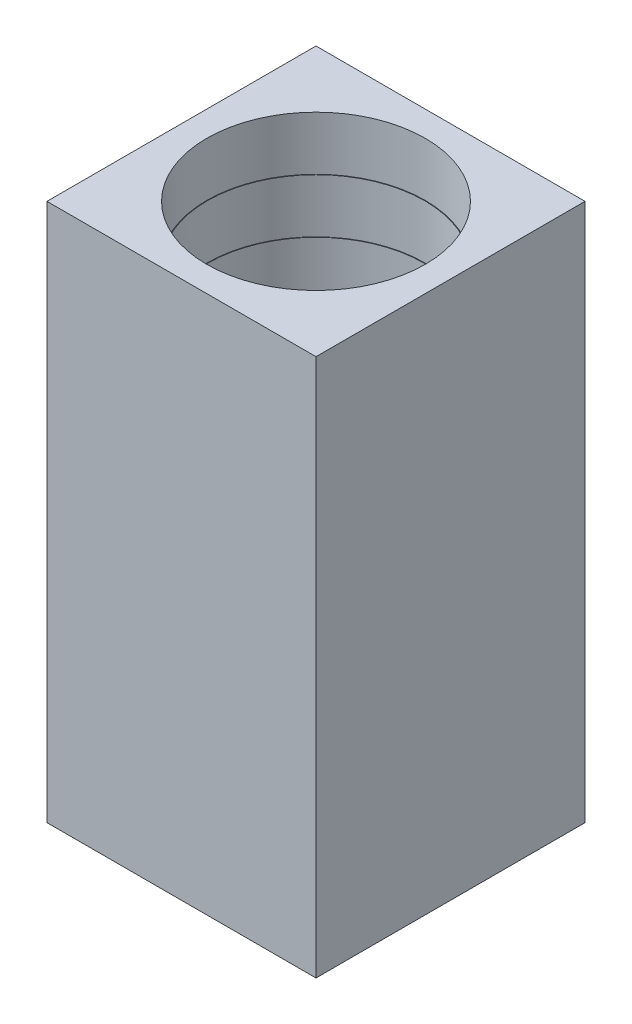
from build123d import *

# Parameters (mm, degrees)
SKETCH1_W           = 50
SKETCH1_H           = 50
BOSS_EXTRUDE1_DEPTH = 100
SKETCH2_R           = 19.9
CUT_EXTRUDE2_DEPTH  = 50
SKETCH2_5_R         = 20
SKETCH2_5_R_2       = 19.9
CUT_EXTRUDE3_DEPTH  = 40
SKETCH2_6_R         = 20.1
SKETCH2_6_R_2       = 20
CUT_EXTRUDE4_DEPTH  = 30
SKETCH2_7_R         = 20.2
SKETCH2_7_R_2       = 20.1
CUT_EXTRUDE5_DEPTH  = 20
SKETCH2_8_R         = 20.3
SKETCH2_8_R_2       = 20.2
CUT_EXTRUDE6_DEPTH  = 10


with BuildPart() as part:
    # Sketch1 → Boss-Extrude1 (new body)
    with BuildSketch(Plane(origin=(0, 0, 0), x_dir=(1, 0, 0), z_dir=(0, 1, 0))):
        Rectangle(SKETCH1_W, SKETCH1_H)
    extrude(amount=BOSS_EXTRUDE1_DEPTH)

    # Sketch2 → Cut-Extrude2 (cut)
    with BuildSketch(Plane(origin=(0, 100, 0), x_dir=(1, 0, 0), z_dir=(0, 1, 0))):
        Circle(SKETCH2_R)
    extrude(amount=-CUT_EXTRUDE2_DEPTH, mode=Mode.SUBTRACT)

    # Sketch2<5> → Cut-Extrude3 (cut)
    with BuildSketch(Plane(origin=(0, 100, 0), x_dir=(1, 0, 0), z_dir=(0, 1, 0))):
        Circle(SKETCH2_5_R)
        Circle(SKETCH2_5_R_2, mode=Mode.SUBTRACT)
    extrude(amount=-CUT_EXTRUDE3_DEPTH, mode=Mode.SUBTRACT)

    # Sketch2<6> → Cut-Extrude4 (cut)
    with BuildSketch(Plane(origin=(0, 100, 0), x_dir=(1, 0, 0), z_dir=(0, 1, 0))):
        Circle(SKETCH2_6_R)
        Circle(SKETCH2_6_R_2, mode=Mode.SUBTRACT)
    extrude(amount=-CUT_EXTRUDE4_DEPTH, mode=Mode.SUBTRACT)

    # Sketch2<7> → Cut-Extrude5 (cut)
    with BuildSketch(Plane(origin=(0, 100, 0), x_dir=(1, 0, 0), z_dir=(0, 1, 0))):
        Circle(SKETCH2_7_R)
        Circle(SKETCH2_7_R_2, mode=Mode.SUBTRACT)
    extrude(amount=-CUT_EXTRUDE5_DEPTH, mode=Mode.SUBTRACT)

    # Sketch2<8> → Cut-Extrude6 (cut)
    with BuildSketch(Plane(origin=(0, 100, 0), x_dir=(1, 0, 0), z_dir=(0, 1, 0))):
        Circle(SKETCH2_8_R)
        Circle(SKETCH2_8_R_2, mode=Mode.SUBTRACT)
    extrude(amount=-CUT_EXTRUDE6_DEPTH, mode=Mode.SUBTRACT)


solid = part.part
